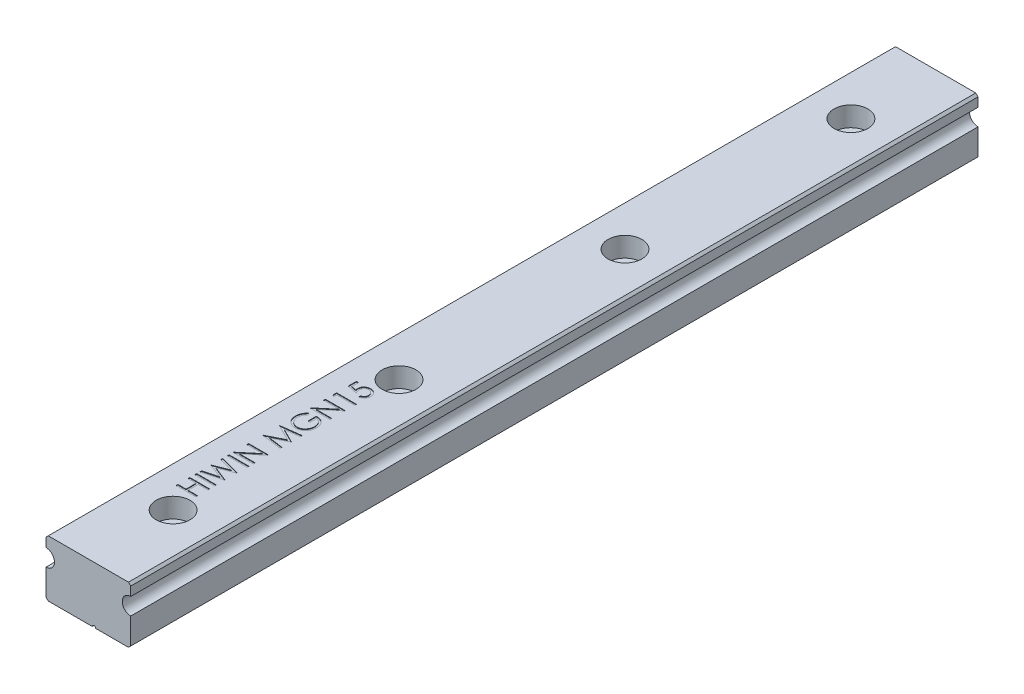
from build123d import *

# Parameters (mm, degrees)
EXTRUDE_1_DEPTH              = 150
HOLE_WIZARD_M3_1_D           = 3.5
HOLE_WIZARD_M3_1_CBORE_D     = 6
HOLE_WIZARD_M3_1_CBORE_DEPTH = 3.5
PATTERN_LINEAR_1_COUNT       = 4
PATTERN_LINEAR_1_PITCH       = 40
SKETCH_6_W                   = 3.5
SKETCH_6_H                   = 0.314102564
CUT_EXTRUDE_1_DEPTH          = 0.1


with BuildPart() as part:
    # 草图1 → 凸台-拉伸1 (new body)
    with BuildSketch(Plane.XY):
        with BuildLine():
            Line((-7.1, 0), (0.7, 0))
            ThreePointArc((0.7, 0), (1, 0.3), (1.3, 0))
            Line((1.3, 0), (7.1, 0))
            Line((7.1, 0), (7.5, 0.4))
            Line((7.5, 0.4), (7.5, 5))
            ThreePointArc((7.5, 5), (6, 6.5), (7.5, 8))
            Line((7.5, 8), (7.5, 9.6))
            Line((7.5, 9.6), (7.1, 10))
            Line((7.1, 10), (-7.1, 10))
            Line((-7.1, 10), (-7.5, 9.6))
            Line((-7.5, 9.6), (-7.5, 8))
            ThreePointArc((-7.5, 8), (-6, 6.5), (-7.5, 5))
            Line((-7.5, 5), (-7.5, 0.4))
            Line((-7.5, 0.4), (-7.1, 0))
        make_face()
    extrude(amount=-EXTRUDE_1_DEPTH)

    # M3 六角凹头螺钉的柱形沉头孔1 (through all)
    with Locations(Plane(origin=(-0.370542997, 10, 7.777563831), x_dir=(-1, 0, 0), z_dir=(0, 1, 0))):
        with Locations((-0.370542997, -22.777563831)):
            hole_wizard_m3_1 = CounterBoreHole(HOLE_WIZARD_M3_1_D / 2, HOLE_WIZARD_M3_1_CBORE_D / 2, HOLE_WIZARD_M3_1_CBORE_DEPTH)

    # 阵列(线性)1: M3 六角凹头螺钉的柱形沉头孔1 ×4
    with Locations(*[(0, 0, -i * PATTERN_LINEAR_1_PITCH) for i in range(1, PATTERN_LINEAR_1_COUNT)]):
        add(hole_wizard_m3_1, mode=Mode.SUBTRACT)

    # 草图6 → 切除-拉伸1 (cut)
    with BuildSketch(Plane(origin=(0, 10, 0), x_dir=(1, 0, 0), z_dir=(0, 1, 0))):
        Polygon((-3.5, 19.048076923), (-3.5, 19.362179487), (-2.064102564, 19.362179487), (-2.064102564, 21.157051282), (-3.5, 21.157051282), (-3.5, 21.471153846), (0, 21.471153846), (0, 21.157051282), (-1.705128205, 21.157051282), (-1.705128205, 19.362179487), (0, 19.362179487), (0, 19.048076923), align=None)
        with Locations((-1.75, 22.525641026)):
            Rectangle(SKETCH_6_W, SKETCH_6_H)
        Polygon((-3.5, 23.221153846), (-3.5, 23.545773237), (-0.933193109, 24.230769231), (-3.5, 25.249499199), (-3.5, 25.295072115), (-0.950721154, 26.294871795), (-3.5, 26.983373397), (-3.5, 27.304487179), (0, 26.360777244), (0, 26.315905449), (-2.676883013, 25.262820513), (0, 24.197115385), (0, 24.15224359), align=None)
        with Locations((-1.75, 28.269230769)):
            Rectangle(SKETCH_6_W, SKETCH_6_H)
        Polygon((0, 29.189102564), (-3.5, 29.189102564), (-3.5, 29.255008013), (-0.745292468, 31.567307692), (-3.5, 31.567307692), (-3.5, 31.881410256), (0, 31.881410256), (0, 31.809895833), (-2.748397436, 29.503205128), (0, 29.503205128), align=None)
        Polygon((0, 33.945512821), (-3.5, 34.407552083), (-3.5, 34.452423878), (-0.628205128, 35.897435897), (-3.5, 37.338942308), (-3.5, 37.384515224), (0, 37.849358974), (0, 37.533854167), (-2.518429487, 37.198717949), (0, 35.935296474), (0, 35.864483173), (-2.524038462, 34.596153846), (0, 34.26171875), align=None)
        with BuildLine():
            Line((-2.902644231, 41.842948718), (-2.647435897, 41.573717949))
            add(Edge.make_bspline(
                [(-2.647435897, 41.573717949), (-2.69328212, 41.525008868), (-2.783881335, 41.428752203), (-2.901244074, 41.271552261), (-3.002777003, 41.108196408), (-3.084772592, 40.938420508), (-3.149094254, 40.766676508), (-3.195850217, 40.595917554), (-3.225460377, 40.427249256), (-3.229016796, 40.315084954), (-3.230769231, 40.259815705)],
                knots=[0, 0, 0, 0, 1.089067066, 2.152164705, 3.18986567, 4.218445106, 5.218487318, 6.173592265, 7.100032889, 8, 8, 8, 8], degree=3))
            add(Edge.make_bspline(
                [(-3.230769231, 40.259815705), (-3.230355625, 40.225901005), (-3.229529486, 40.158159565), (-3.218985271, 40.057537621), (-3.203820407, 39.957970983), (-3.181878529, 39.859647609), (-3.15406947, 39.762376321), (-3.119284004, 39.666495434), (-3.078728771, 39.571826062), (-3.031866252, 39.479260043), (-2.980386575, 39.38951931), (-2.923337414, 39.304763314), (-2.862550889, 39.224446852), (-2.796491613, 39.150097645), (-2.725807311, 39.081221131), (-2.651770944, 39.01655043), (-2.572926872, 38.957290852), (-2.489599321, 38.904505212), (-2.403726867, 38.856837618), (-2.316037795, 38.815645418), (-2.227346143, 38.779835464), (-2.136984078, 38.752561503), (-2.045883197, 38.729460629), (-1.953566086, 38.713379393), (-1.859791669, 38.704283076), (-1.796993971, 38.702712585), (-1.765424679, 38.701923077)],
                knots=[0, 0, 0, 0, 1.028150113, 2.053633673, 3.06513288, 4.081487945, 5.106702018, 6.131327874, 7.172780699, 8.228344599, 9.276313556, 10.308389736, 11.324843658, 12.329040066, 13.321460474, 14.316307835, 15.308626991, 16.309440696, 17.305625405, 18.28535951, 19.246194545, 20.203493668, 21.145557131, 22.095268976, 23.042464743, 24, 24, 24, 24], degree=3))
            add(Edge.make_bspline(
                [(-1.765424679, 38.701923077), (-1.733154018, 38.702679272), (-1.668700816, 38.704189598), (-1.572504414, 38.713842795), (-1.477747832, 38.731798005), (-1.384282029, 38.755609755), (-1.291920993, 38.78588243), (-1.20076111, 38.823074944), (-1.110811241, 38.867381076), (-1.022964324, 38.918552345), (-0.937464192, 38.975061813), (-0.856251713, 39.037212997), (-0.780271995, 39.105110534), (-0.708415252, 39.177509477), (-0.641134974, 39.255069473), (-0.579242122, 39.338543005), (-0.521779643, 39.426761597), (-0.469378807, 39.519764386), (-0.42257144, 39.616568366), (-0.38094723, 39.715824797), (-0.346667976, 39.817852699), (-0.31872985, 39.922115365), (-0.295829559, 40.028488643), (-0.281097077, 40.137512444), (-0.270406246, 40.248385153), (-0.269624576, 40.323123785), (-0.269230769, 40.360777244)],
                knots=[0, 0, 0, 0, 0.935915162, 1.869274651, 2.799799983, 3.730201895, 4.664668062, 5.616159355, 6.583070886, 7.570012957, 8.562524459, 9.553461134, 10.53281078, 11.515274572, 12.509912756, 13.507571325, 14.526460018, 15.561318395, 16.601025881, 17.643204557, 18.680545676, 19.719612342, 20.772381578, 21.833430283, 22.908478249, 24, 24, 24, 24], degree=3))
            add(Edge.make_bspline(
                [(-0.269230769, 40.360777244), (-0.270178952, 40.406155776), (-0.272040863, 40.495263896), (-0.286546735, 40.626247716), (-0.309173205, 40.752060334), (-0.342412256, 40.872292172), (-0.384484705, 40.987379567), (-0.436513285, 41.096898055), (-0.497950569, 41.201150049), (-0.567552463, 41.299684309), (-0.645100929, 41.39015833), (-0.728035637, 41.472500409), (-0.817431068, 41.543879031), (-0.911954918, 41.606426348), (-1.012511326, 41.658123592), (-1.118540888, 41.70056947), (-1.230109213, 41.733101926), (-1.307200733, 41.746457015), (-1.346153846, 41.753205128)],
                knots=[0, 0, 0, 0, 1.130199668, 2.219330667, 3.279027493, 4.311506524, 5.322739849, 6.327972234, 7.327472899, 8.33386792, 9.329086447, 10.29244429, 11.240784345, 12.174119183, 13.111530729, 14.052100829, 15.015757696, 16, 16, 16, 16], degree=3))
            Line((-1.346153846, 41.753205128), (-1.346153846, 40.586538462))
            Line((-1.346153846, 40.586538462), (-1.705128205, 40.586538462))
            Line((-1.705128205, 40.586538462), (-1.705128205, 42.067307692))
            add(Edge.make_bspline(
                [(-1.705128205, 42.067307692), (-1.638220716, 42.065601844), (-1.507270675, 42.062263191), (-1.316300404, 42.038844275), (-1.13592871, 42.001027763), (-0.965965639, 41.949367451), (-0.806652046, 41.88249217), (-0.65782618, 41.801119642), (-0.520449499, 41.703947521), (-0.393400495, 41.594437079), (-0.280071283, 41.471537122), (-0.180465345, 41.338568502), (-0.09656273, 41.195311533), (-0.028302067, 41.041901726), (0.024971927, 40.878841292), (0.062743504, 40.705752913), (0.085373467, 40.522871312), (0.088264847, 40.397534635), (0.08974359, 40.333433494)],
                knots=[0, 0, 0, 0, 1.140356446, 2.231883559, 3.274166699, 4.278491846, 5.25512956, 6.21435461, 7.1637429, 8.11826594, 9.068280886, 10.0076534, 10.945064095, 11.891975133, 12.864533718, 13.863980011, 14.907571808, 16, 16, 16, 16], degree=3))
            add(Edge.make_bspline(
                [(0.08974359, 40.333433494), (0.089174469, 40.293923358), (0.088051978, 40.215996637), (0.080074631, 40.100905709), (0.067794054, 39.988988089), (0.049248931, 39.88026008), (0.026534277, 39.774321738), (-0.002552442, 39.671702153), (-0.036221141, 39.572010411), (-0.074516815, 39.475092425), (-0.118888472, 39.381827878), (-0.168198111, 39.291801361), (-0.222191472, 39.204515236), (-0.281802318, 39.120564071), (-0.346584778, 39.039510449), (-0.416668697, 38.961877005), (-0.491839816, 38.887229127), (-0.545218826, 38.840468664), (-0.572115385, 38.816907051)],
                knots=[0, 0, 0, 0, 1.107784379, 2.184907829, 3.233506516, 4.263428166, 5.276301166, 6.270063455, 7.25232949, 8.225834625, 9.190232166, 10.146266622, 11.1027726, 12.066435141, 13.031522626, 14.010570082, 14.99756817, 16, 16, 16, 16], degree=3))
            add(Edge.make_bspline(
                [(-0.572115385, 38.816907051), (-0.614786038, 38.782721119), (-0.699419055, 38.714916707), (-0.835018999, 38.62763855), (-0.975420859, 38.553237147), (-1.121015488, 38.492869325), (-1.271666701, 38.445731239), (-1.427181992, 38.411924986), (-1.587761622, 38.392117697), (-1.696426887, 38.389264159), (-1.751402244, 38.387820513)],
                knots=[0, 0, 0, 0, 1.023165419, 2.029347347, 3.013907458, 3.994755782, 4.975994455, 5.96558838, 6.970761222, 8, 8, 8, 8], degree=3))
            add(Edge.make_bspline(
                [(-1.751402244, 38.387820513), (-1.792568496, 38.388352751), (-1.874377804, 38.389410462), (-1.99583511, 38.40223598), (-2.115135808, 38.420637392), (-2.232182344, 38.447684468), (-2.347053012, 38.481780654), (-2.45980069, 38.524334435), (-2.570493643, 38.573878213), (-2.67836343, 38.63146793), (-2.782003044, 38.695536667), (-2.880905313, 38.765144323), (-2.973467332, 38.840828008), (-3.059903521, 38.922808103), (-3.141494975, 39.009432033), (-3.216537375, 39.102518334), (-3.286205011, 39.20065667), (-3.349159221, 39.30460781), (-3.405727075, 39.412731441), (-3.455315154, 39.524792527), (-3.496298775, 39.640750345), (-3.531072472, 39.759737902), (-3.556787635, 39.882655381), (-3.575436374, 40.008610924), (-3.588196976, 40.138261034), (-3.589223231, 40.225897064), (-3.58974359, 40.270332532)],
                knots=[0, 0, 0, 0, 1.00895651, 2.005089799, 2.991467152, 3.967318338, 4.948153826, 5.927364234, 6.919980553, 7.91976625, 8.923240147, 9.905815003, 10.88314567, 11.851989312, 12.825009789, 13.798721852, 14.781296708, 15.773896486, 16.776076962, 17.771600213, 18.775744723, 19.78957137, 20.808953803, 21.851964491, 22.910847925, 24, 24, 24, 24], degree=3))
            add(Edge.make_bspline(
                [(-3.58974359, 40.270332532), (-3.589164098, 40.306570776), (-3.588015034, 40.378426954), (-3.580050386, 40.485352687), (-3.567426505, 40.590625701), (-3.550199718, 40.694402091), (-3.526736028, 40.796328458), (-3.498657743, 40.896695163), (-3.46596592, 40.995647699), (-3.426977074, 41.092875948), (-3.382723449, 41.189033664), (-3.332910027, 41.284655505), (-3.276685022, 41.379414751), (-3.213881487, 41.473475732), (-3.145578069, 41.56743159), (-3.069821245, 41.659796233), (-2.989598489, 41.752799177), (-2.931916305, 41.812600991), (-2.902644231, 41.842948718)],
                knots=[0, 0, 0, 0, 0.985871117, 1.954866573, 2.915460327, 3.869826059, 4.81536089, 5.759505086, 6.70452669, 7.649098992, 8.607881297, 9.583363685, 10.581137262, 11.603961102, 12.659522466, 13.73993555, 14.853081303, 16, 16, 16, 16], degree=3))
        make_face()
        Polygon((0, 42.78525641), (-3.5, 42.78525641), (-3.5, 42.851161859), (-0.745292468, 45.163461538), (-3.5, 45.163461538), (-3.5, 45.477564103), (0, 45.477564103), (0, 45.406049679), (-2.748397436, 43.099358974), (0, 43.099358974), align=None)
        Polygon((-3.5, 46.80478766), (-3.5, 47.451923077), (0, 47.451923077), (0, 47.137820513), (-3.141025641, 47.137820513), (-3.141025641, 46.599358974), align=None)
        with BuildLine():
            Line((-3.5, 50.951923077), (-3.141025641, 50.951923077))
            Line((-3.141025641, 50.951923077), (-3.141025641, 49.761418269))
            Line((-3.141025641, 49.761418269), (-2.220452724, 49.572816506))
            add(Edge.make_bspline(
                [(-2.220452724, 49.572816506), (-2.230682996, 49.609872381), (-2.25050253, 49.681662277), (-2.2725083, 49.787622138), (-2.285773744, 49.888214341), (-2.287585055, 49.953489711), (-2.288461538, 49.985076122)],
                knots=[0, 0, 0, 0, 1.100273476, 2.13160584, 3.095893838, 4, 4, 4, 4], degree=3))
            add(Edge.make_bspline(
                [(-2.288461538, 49.985076122), (-2.28764354, 50.024167036), (-2.28603515, 50.10102954), (-2.269673986, 50.213313845), (-2.245976174, 50.321041181), (-2.209465207, 50.422620963), (-2.164878805, 50.519660286), (-2.108721258, 50.610492617), (-2.04315746, 50.696392791), (-1.968525078, 50.77676711), (-1.885534459, 50.849340108), (-1.795933934, 50.912403652), (-1.701678739, 50.967446427), (-1.600559725, 51.010374852), (-1.494484031, 51.045408634), (-1.382227183, 51.068509998), (-1.264785773, 51.083940708), (-1.18448027, 51.085661148), (-1.143529647, 51.086538462)],
                knots=[0, 0, 0, 0, 1.052805225, 2.070078116, 3.052532748, 4.020689046, 4.973125432, 5.925915817, 6.89216474, 7.881560752, 8.877013184, 9.857446635, 10.830895175, 11.812622661, 12.812548702, 13.836681939, 14.896847428, 16, 16, 16, 16], degree=3))
            add(Edge.make_bspline(
                [(-1.143529647, 51.086538462), (-1.115007605, 51.085872787), (-1.058348972, 51.084550434), (-0.974202158, 51.07784063), (-0.891849045, 51.064872238), (-0.811440613, 51.047672121), (-0.732901554, 51.024710814), (-0.65579213, 50.997853392), (-0.580956685, 50.964471393), (-0.508064701, 50.927463719), (-0.437950402, 50.886484695), (-0.372294905, 50.840404693), (-0.309599937, 50.792524916), (-0.251727444, 50.74020742), (-0.198452948, 50.684047026), (-0.149513072, 50.624356217), (-0.104029493, 50.561676398), (-0.063861909, 50.495020368), (-0.026898788, 50.425878098), (0.003424705, 50.353249824), (0.030535245, 50.278789139), (0.05214477, 50.201424259), (0.069077325, 50.121330447), (0.080577925, 50.038375671), (0.088954363, 49.952995002), (0.08947872, 49.895119989), (0.08974359, 49.865885417)],
                knots=[0, 0, 0, 0, 1.056393913, 2.098511576, 3.122979385, 4.141471433, 5.141222888, 6.151259816, 7.162667642, 8.172852865, 9.177685681, 10.166741883, 11.141342384, 12.097242845, 13.052202613, 14.005160326, 14.953864445, 15.917140761, 16.884916217, 17.854238259, 18.828761908, 19.81781811, 20.826036654, 21.857789401, 22.917898972, 24, 24, 24, 24], degree=3))
            add(Edge.make_bspline(
                [(0.08974359, 49.865885417), (0.089050894, 49.831012125), (0.087688097, 49.762403044), (0.073496095, 49.661869801), (0.053035464, 49.565201486), (0.022721931, 49.472812407), (-0.016971483, 49.385087879), (-0.064133263, 49.300771706), (-0.12027864, 49.220908949), (-0.184894072, 49.146045608), (-0.255892818, 49.077229602), (-0.332202561, 49.014826741), (-0.413920487, 48.959963104), (-0.500780871, 48.912439675), (-0.592629648, 48.871954046), (-0.689749822, 48.840135639), (-0.791650601, 48.814458221), (-0.861804004, 48.803594672), (-0.897435897, 48.798076923)],
                knots=[0, 0, 0, 0, 1.046872515, 2.059598001, 3.044168548, 4.012104806, 4.973680974, 5.932408326, 6.910122221, 7.900780896, 8.89867654, 9.876692837, 10.858029398, 11.85084981, 12.847361615, 13.868568023, 14.917415949, 16, 16, 16, 16], degree=3))
            Line((-0.897435897, 48.798076923), (-0.897435897, 49.112179487))
            add(Edge.make_bspline(
                [(-0.897435897, 49.112179487), (-0.86405597, 49.11990321), (-0.799897896, 49.134748633), (-0.709812799, 49.167418724), (-0.62950762, 49.20697569), (-0.558491359, 49.255109627), (-0.495464081, 49.310903023), (-0.43989307, 49.375759962), (-0.389697273, 49.448059042), (-0.347784769, 49.52844142), (-0.312479137, 49.613409483), (-0.287283878, 49.701832582), (-0.272032646, 49.792438135), (-0.270168243, 49.853440754), (-0.269230769, 49.884114583)],
                knots=[0, 0, 0, 0, 1.13623081, 2.183898708, 3.172478118, 4.09966615, 5.022692284, 5.957376522, 6.927682873, 7.937366477, 8.960015386, 9.976409503, 10.982481913, 12, 12, 12, 12], degree=3))
            add(Edge.make_bspline(
                [(-0.269230769, 49.884114583), (-0.270058415, 49.914070486), (-0.271688055, 49.973053905), (-0.284028564, 50.059901743), (-0.303533592, 50.143504997), (-0.33085902, 50.224012074), (-0.367008958, 50.301027376), (-0.411417074, 50.374442012), (-0.462975425, 50.445301838), (-0.521904738, 50.511741931), (-0.586881759, 50.572578173), (-0.656357238, 50.626335132), (-0.730474586, 50.671111826), (-0.807947606, 50.708845993), (-0.889626199, 50.737499276), (-0.975127364, 50.757940262), (-1.064662347, 50.76994332), (-1.125731657, 50.7715945), (-1.156850962, 50.772435897)],
                knots=[0, 0, 0, 0, 1.027268864, 2.022700798, 3.002744649, 3.968653148, 4.933396556, 5.915045722, 6.907600446, 7.935526002, 8.956456544, 9.95700807, 10.942805781, 11.92166854, 12.907987664, 13.905483474, 14.932689774, 16, 16, 16, 16], degree=3))
            add(Edge.make_bspline(
                [(-1.156850962, 50.772435897), (-1.184930032, 50.771797425), (-1.239659043, 50.770552977), (-1.320009695, 50.759779873), (-1.396158478, 50.741783572), (-1.468436727, 50.716160495), (-1.536613353, 50.684182076), (-1.600538112, 50.644032202), (-1.660812066, 50.597420489), (-1.715884112, 50.54300237), (-1.766793088, 50.483806721), (-1.810034281, 50.418313096), (-1.846807397, 50.348269932), (-1.876936465, 50.273547427), (-1.900936575, 50.194053541), (-1.917523378, 50.109745458), (-1.92744867, 50.020603964), (-1.928795087, 49.95962832), (-1.929487179, 49.928285256)],
                knots=[0, 0, 0, 0, 1.045723156, 2.038222538, 3.013889863, 3.95567481, 4.890389958, 5.81331128, 6.76251276, 7.723027653, 8.692928204, 9.666105983, 10.639751036, 11.635719707, 12.66315958, 13.728667616, 14.832476222, 16, 16, 16, 16], degree=3))
            add(Edge.make_bspline(
                [(-1.929487179, 49.928285256), (-1.928906588, 49.901156328), (-1.927707815, 49.845141972), (-1.918881318, 49.759219146), (-1.904642024, 49.668927423), (-1.885055776, 49.574612927), (-1.859424699, 49.475992419), (-1.828710199, 49.373274018), (-1.7919882, 49.266241752), (-1.764255986, 49.194124027), (-1.75, 49.157051282)],
                knots=[0, 0, 0, 0, 0.817624296, 1.688186739, 2.600797293, 3.572016777, 4.590301741, 5.671205678, 6.80286297, 8, 8, 8, 8], degree=3))
            Line((-1.75, 49.157051282), (-3.5, 49.516025641))
            Line((-3.5, 49.516025641), (-3.5, 50.951923077))
        make_face()
    extrude(amount=-CUT_EXTRUDE_1_DEPTH, mode=Mode.SUBTRACT)


solid = part.part
